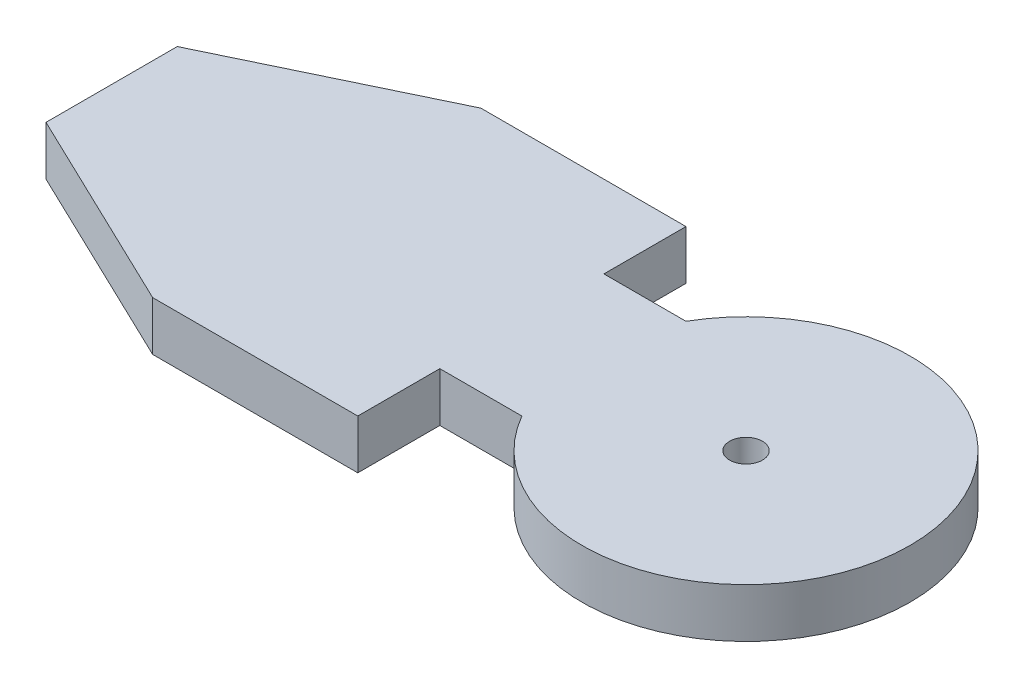
from build123d import *

# Parameters (mm, degrees)
BOSS_EXTRUDE1_DEPTH = 3
SKETCH2_R           = 1
CUT_EXTRUDE1_DEPTH  = 13


with BuildPart() as part:
    # Sketch1 → Boss-Extrude1 (new body)
    with BuildSketch(Plane(origin=(0, 0, 0), x_dir=(1, 0, 0), z_dir=(0, 1, 0))):
        with BuildLine():
            Line((-12.5, 0), (-25, 6))
            Line((-25, 6), (-25, 14))
            Line((-25, 14), (-12.5, 20))
            Line((-12.5, 20), (0, 20))
            Line((0, 20), (0, 15))
            Line((0, 15), (5, 15))
            ThreePointArc((5, 15), (23.660254038, 10), (5, 5))
            Line((5, 5), (0, 5))
            Line((0, 5), (0, 0))
            Line((0, 0), (-12.5, 0))
        make_face()
    extrude(amount=BOSS_EXTRUDE1_DEPTH)

    # Sketch2 → Cut-Extrude1 (cut)
    with BuildSketch(Plane(origin=(0, 3, 0), x_dir=(1, 0, 0), z_dir=(0, 1, 0))):
        with Locations(Location((13.660254038, 10, 0), (0, 0, 270))):
            Circle(SKETCH2_R)
    extrude(amount=-CUT_EXTRUDE1_DEPTH, mode=Mode.SUBTRACT)


solid = part.part
